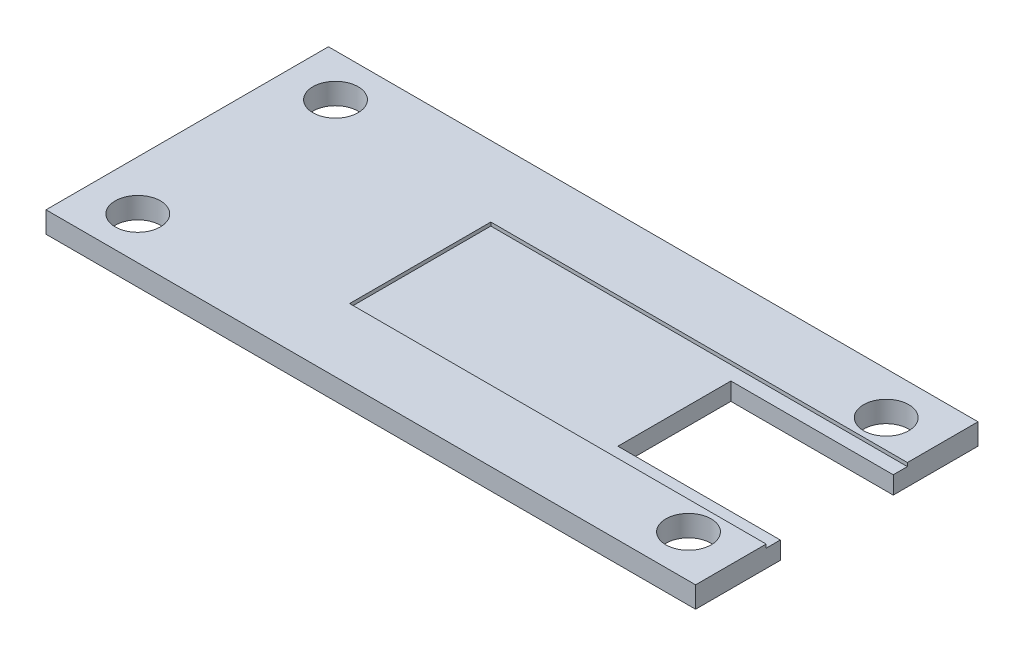
from build123d import *

# Parameters (mm, degrees)
SKETCH_1_W          = 46
SKETCH_1_H          = 20
SKETCH_1_R          = 1.6
EXTRUDE_1_DEPTH     = 1.5
SKETCH_2_W          = 29.5
SKETCH_2_H          = 10
CUT_EXTRUDE_1_DEPTH = 0.25
SKETCH_3_W          = 11.5
SKETCH_3_H          = 8
CUT_EXTRUDE_2_DEPTH = 30.25


with BuildPart() as part:
    # 草图1 → 凸台-拉伸1 (new body)
    with BuildSketch(Plane(origin=(0, 0, 0), x_dir=(1, 0, 0), z_dir=(0, 1, 0))):
        Rectangle(SKETCH_1_W, SKETCH_1_H)
        with Locations(Location((-19.5, 7, 0), (0, 0, 270))):
            Circle(SKETCH_1_R, mode=Mode.SUBTRACT)
        with Locations(Location((19.5, 7, 0), (0, 0, 90))):
            Circle(SKETCH_1_R, mode=Mode.SUBTRACT)
        with Locations(Location((19.5, -7, 0), (0, 0, 270))):
            Circle(SKETCH_1_R, mode=Mode.SUBTRACT)
        with Locations(Location((-19.5, -7, 0), (0, 0, 90))):
            Circle(SKETCH_1_R, mode=Mode.SUBTRACT)
    extrude(amount=EXTRUDE_1_DEPTH)

    # 草图2 → 切除-拉伸1 (cut)
    with BuildSketch(Plane(origin=(0, 1.5, 0), x_dir=(1, 0, 0), z_dir=(0, 1, 0))):
        with Locations((8.25, 0)):
            Rectangle(SKETCH_2_W, SKETCH_2_H)
    extrude(amount=-CUT_EXTRUDE_1_DEPTH, mode=Mode.SUBTRACT)

    # 草图3 → 切除-拉伸2 (cut)
    with BuildSketch(Plane(origin=(0, 1.25, 0), x_dir=(1, 0, 0), z_dir=(0, 1, 0))):
        with Locations((17.25, 0)):
            Rectangle(SKETCH_3_W, SKETCH_3_H)
    extrude(amount=-CUT_EXTRUDE_2_DEPTH, mode=Mode.SUBTRACT)


solid = part.part
